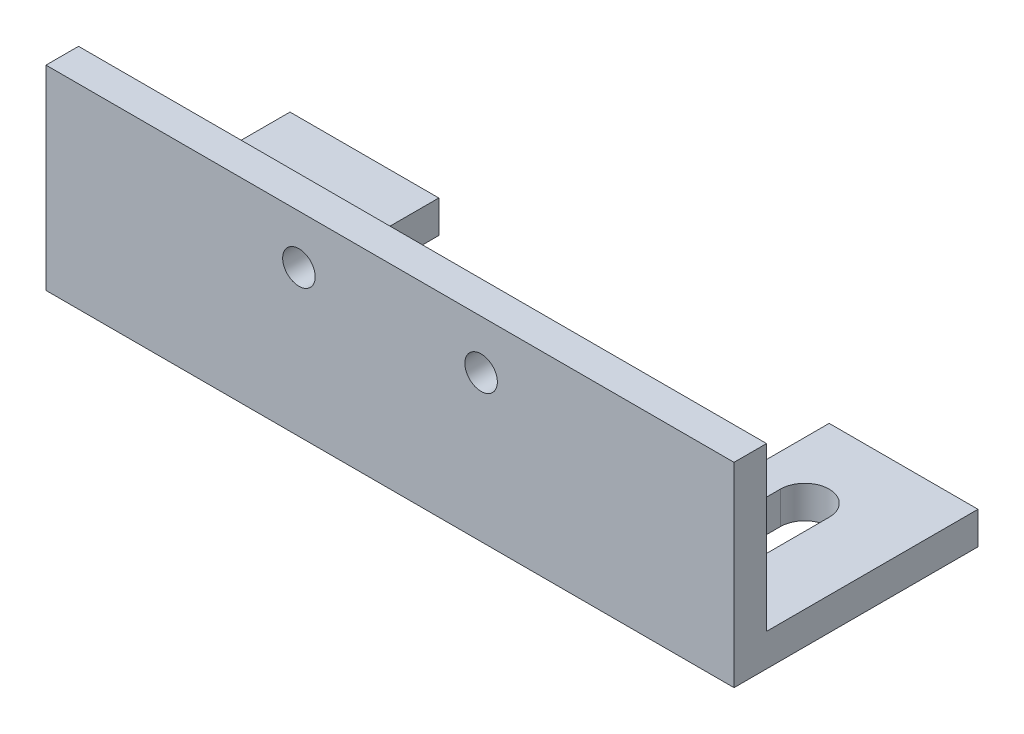
from build123d import *

# Parameters (mm, degrees)
DODANIE_WYCI_GNI_CIE1_DEPTH = 2
SZKIC4_W                    = 42.3
SZKIC4_H                    = 12
SZKIC4_R                    = 1
DODANIE_WYCI_GNI_CIE2_DEPTH = 2


with BuildPart() as part:
    # Szkic1 → Dodanie-wyciągnięcie1 (new body)
    with BuildSketch(Plane(origin=(0, 0, 0), x_dir=(1, 0, 0), z_dir=(0, 1, 0))):
        Polygon((-21.15, 7.5), (-12, 7.5), (-12, -2.5), (12, -2.5), (12, 7.5), (21.15, 7.5), (21.15, -7.5), (-21.15, -7.5), align=None)
        with BuildLine():
            Line((-14, 2.5), (-14, -2.5))
            ThreePointArc((-14, -2.5), (-15.5, -4), (-17, -2.5))
            Line((-17, -2.5), (-17, 2.5))
            ThreePointArc((-17, 2.5), (-15.5, 4), (-14, 2.5))
        make_face(mode=Mode.SUBTRACT)
        with BuildLine():
            Line((17, 2.5), (17, -2.5))
            ThreePointArc((17, -2.5), (15.5, -4), (14, -2.5))
            Line((14, -2.5), (14, 2.5))
            ThreePointArc((14, 2.5), (15.5, 4), (17, 2.5))
        make_face(mode=Mode.SUBTRACT)
    extrude(amount=DODANIE_WYCI_GNI_CIE1_DEPTH)

    # Szkic4 → Dodanie-wyciągnięcie2 (add)
    with BuildSketch(Plane.XY.offset(7.5)):
        with Locations((0, 6)):
            Rectangle(SZKIC4_W, SZKIC4_H)
        with Locations((-5.6, 9)):
            Circle(SZKIC4_R, mode=Mode.SUBTRACT)
        with Locations((5.6, 9)):
            Circle(SZKIC4_R, mode=Mode.SUBTRACT)
    extrude(amount=-DODANIE_WYCI_GNI_CIE2_DEPTH)


solid = part.part
